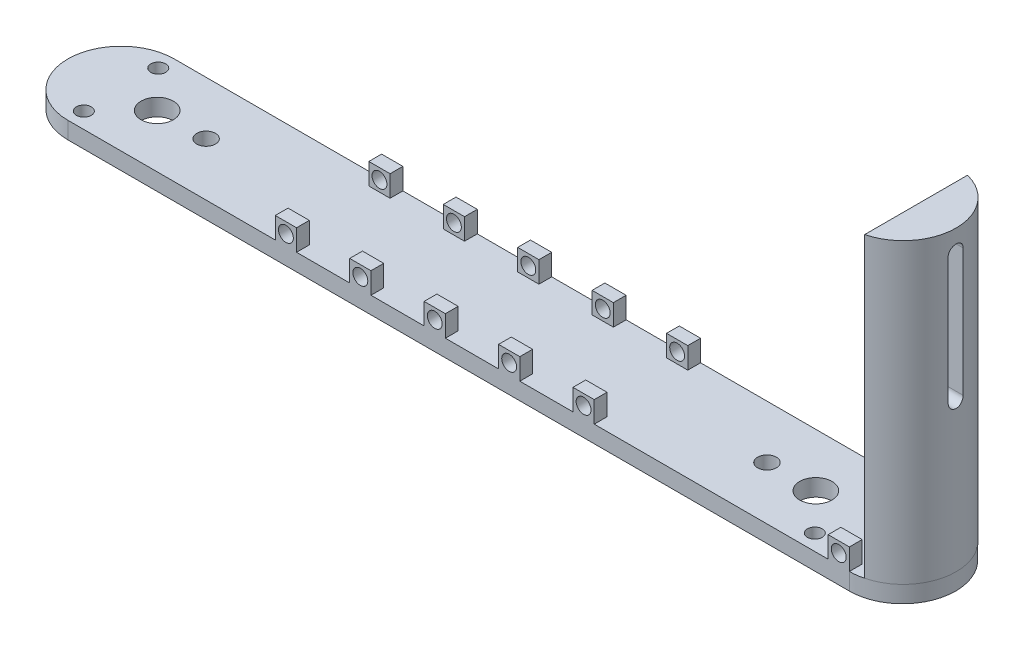
from build123d import *

# Parameters (mm, degrees)
SKETCH1_R               = 3.8
SKETCH1_R_2             = 1.75
SKETCH1_R_3             = 2.2
BOSS_EXTRUDE1_DEPTH     = 4
BOSS_EXTRUDE2_DEPTH     = 70
CUT_EXTRUDE1_DEPTH      = 10
CUT_EXTRUDE1_DEPTH_BACK = 17
SKETCH6_W               = 5
SKETCH6_H               = 3
BOSS_EXTRUDE4_DEPTH     = 5
SKETCH7_R               = 1.75
CUT_EXTRUDE2_DEPTH      = 35


with BuildPart() as part:
    # Sketch1 → Boss-Extrude1 (new body)
    with BuildSketch(Plane(origin=(0, 0, 0), x_dir=(1, 0, 0), z_dir=(0, 1, 0))):
        with BuildLine():
            Line((-91.885, 12.5), (91.885, 12.5))
            ThreePointArc((91.885, 12.5), (104.385, 0), (91.885, -12.5))
            Line((91.885, -12.5), (-91.885, -12.5))
            ThreePointArc((-91.885, -12.5), (-104.385, 0), (-91.885, 12.5))
        make_face()
        with Locations(Location((71.5, 0, 0), (0, 0, 270))):
            Circle(SKETCH1_R, mode=Mode.SUBTRACT)
        with Locations(Location((-91.885, 8.75, 0), (0, 0, 270))):
            Circle(SKETCH1_R_2, mode=Mode.SUBTRACT)
        with Locations(Location((-91.885, -8.75, 0), (0, 0, 270))):
            Circle(SKETCH1_R_2, mode=Mode.SUBTRACT)
        with Locations(Location((-83.385, 0, 0), (0, 0, 270))):
            Circle(SKETCH1_R, mode=Mode.SUBTRACT)
        with Locations(Location((-71.885, 0, 0), (0, 0, 270))):
            Circle(SKETCH1_R_3, mode=Mode.SUBTRACT)
        with Locations(Location((60, 0, 0), (0, 0, 270))):
            Circle(SKETCH1_R_3, mode=Mode.SUBTRACT)
        with Locations(Location((80, 8.75, 0), (0, 0, 270))):
            Circle(SKETCH1_R_2, mode=Mode.SUBTRACT)
        with Locations(Location((80, -8.75, 0), (0, 0, 270))):
            Circle(SKETCH1_R_2, mode=Mode.SUBTRACT)
    extrude(amount=BOSS_EXTRUDE1_DEPTH)

    # Sketch2 → Boss-Extrude2 (add)
    with BuildSketch(Plane(origin=(0, 4, 0), x_dir=(1, 0, 0), z_dir=(0, 1, 0))):
        with BuildLine():
            Line((95.073755841, -12.086431905), (95.073755841, 12.086431905))
            ThreePointArc((95.073755841, 12.086431905), (104.495591505, 0), (95.073755841, -12.086431905))
        make_face()
    extrude(amount=BOSS_EXTRUDE2_DEPTH)

    # Sketch5 → Cut-Extrude1 (cut, two sides: drawn at the far end of the back side and taken through both)
    with BuildSketch(Plane.ZY.offset(-95.073755841).offset(-CUT_EXTRUDE1_DEPTH_BACK)):
        with BuildLine():
            Line((-1.75, 39), (-1.75, 69))
            ThreePointArc((-1.75, 69), (0, 70.75), (1.75, 69))
            Line((1.75, 69), (1.75, 39))
            ThreePointArc((1.75, 39), (0, 37.25), (-1.75, 39))
        make_face()
    extrude(amount=CUT_EXTRUDE1_DEPTH + CUT_EXTRUDE1_DEPTH_BACK, mode=Mode.SUBTRACT)

    # Sketch6 → Boss-Extrude4 (add)
    with BuildSketch(Plane(origin=(0, 4, 0), x_dir=(1, 0, 0), z_dir=(0, 1, 0))):
        with Locations((89.385, -11)):
            Rectangle(SKETCH6_W, SKETCH6_H)
        with Locations((29.385, -11)):
            Rectangle(SKETCH6_W, SKETCH6_H)
        with Locations((11.885, -11)):
            Rectangle(SKETCH6_W, SKETCH6_H)
        with Locations((-5.615, -11)):
            Rectangle(SKETCH6_W, SKETCH6_H)
        with Locations((-23.115, -11)):
            Rectangle(SKETCH6_W, SKETCH6_H)
        with Locations((-40.615, -11)):
            Rectangle(SKETCH6_W, SKETCH6_H)
        with Locations((89.385, 11)):
            Rectangle(SKETCH6_W, SKETCH6_H)
        with Locations((29.385, 11)):
            Rectangle(SKETCH6_W, SKETCH6_H)
        with Locations((11.885, 11)):
            Rectangle(SKETCH6_W, SKETCH6_H)
        with Locations((-5.615, 11)):
            Rectangle(SKETCH6_W, SKETCH6_H)
        with Locations((-23.115, 11)):
            Rectangle(SKETCH6_W, SKETCH6_H)
        with Locations((-40.615, 11)):
            Rectangle(SKETCH6_W, SKETCH6_H)
    extrude(amount=BOSS_EXTRUDE4_DEPTH)

    # Sketch7 → Cut-Extrude2 (cut)
    with BuildSketch(Plane.XY.offset(12.5)):
        with Locations((89.385, 6.5)):
            Circle(SKETCH7_R)
        with Locations((29.385, 6.5)):
            Circle(SKETCH7_R)
        with Locations((11.885, 6.5)):
            Circle(SKETCH7_R)
        with Locations((-5.615, 6.5)):
            Circle(SKETCH7_R)
        with Locations((-23.115, 6.5)):
            Circle(SKETCH7_R)
        with Locations((-40.615, 6.5)):
            Circle(SKETCH7_R)
    extrude(amount=-CUT_EXTRUDE2_DEPTH, mode=Mode.SUBTRACT)


solid = part.part
